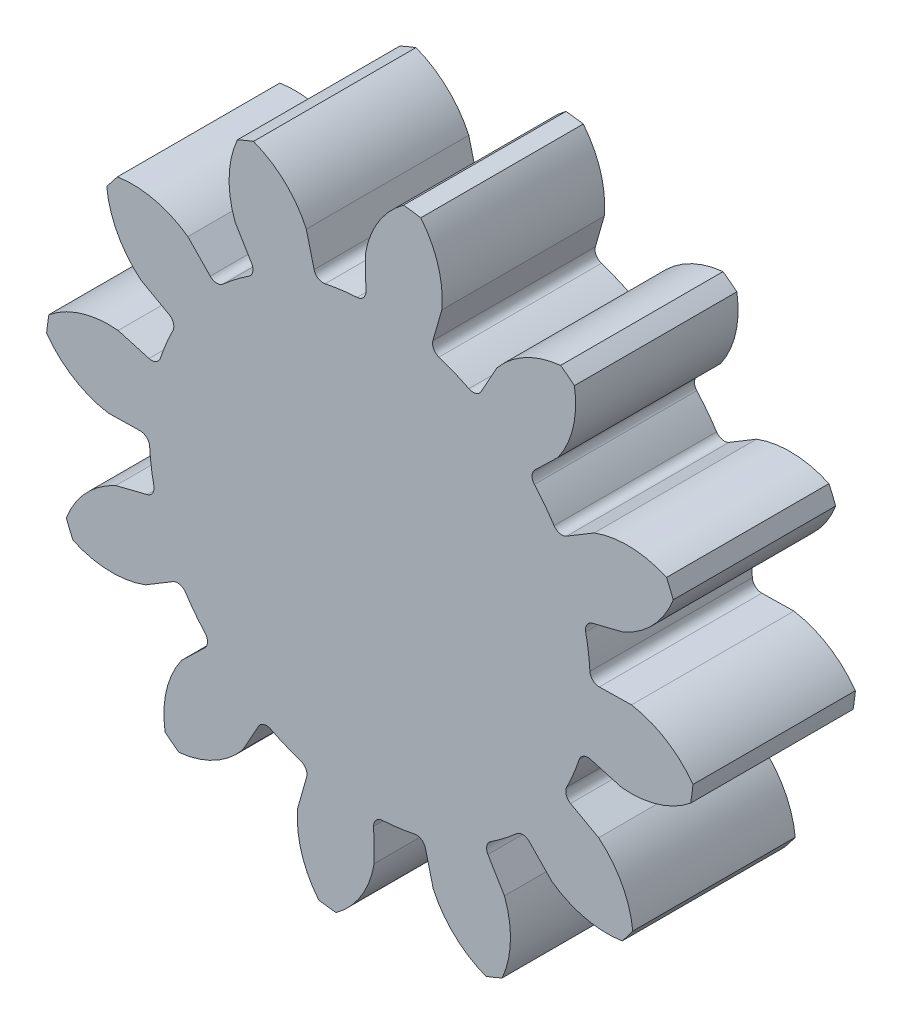
from build123d import *

# Parameters (mm, degrees)
EXTRUDE_1_DEPTH = 2.5


with BuildPart() as part:
    # 草图1 → 凸台-拉伸1 (new, symmetric)
    with BuildSketch(Plane.XY):
        with BuildLine():
            Line((-0.136485783, 8.054358659), (-0.119729389, 7.065523046))
            ThreePointArc((-0.119729389, 7.065523046), (-0.196017091, 6.866270148), (-0.389057023, 6.775401479))
            ThreePointArc((-0.389057023, 6.775401479), (-0.637871764, 6.756519087), (-0.885824161, 6.728502517))
            ThreePointArc((-0.885824161, 6.728502517), (-1.132579008, 6.691389643), (-1.377802715, 6.645230639))
            ThreePointArc((-1.377802715, 6.645230639), (-1.587783513, 6.683040623), (-1.713042218, 6.855759432))
            Line((-1.713042218, 6.855759432), (-1.952786274, 7.815238163))
            ThreePointArc((-1.952786274, 7.815238163), (-2.075107996, 8.053906443), (-2.218726264, 8.280399146))
            ThreePointArc((-2.218726264, 8.280399146), (-2.818977804, 8.911940261), (-3.578316614, 9.339199739))
            ThreePointArc((-3.578316614, 9.339199739), (-3.827312678, 9.239950175), (-4.073559524, 9.13406341))
            ThreePointArc((-4.073559524, 9.13406341), (-4.308375071, 8.295011713), (-4.28625, 7.424002774))
            ThreePointArc((-4.28625, 7.424002774), (-4.227648925, 7.162294797), (-4.145379485, 6.907036319))
            Line((-4.145379485, 6.907036319), (-3.636450216, 6.059057754))
            ThreePointArc((-3.636450216, 6.059057754), (-3.602890854, 5.848355832), (-3.724634005, 5.67314129))
            ThreePointArc((-3.724634005, 5.67314129), (-3.930672695, 5.532381289), (-4.131397486, 5.384142028))
            ThreePointArc((-4.131397486, 5.384142028), (-4.326537014, 5.228623914), (-4.515827472, 5.06603719))
            ThreePointArc((-4.515827472, 5.06603719), (-4.716581169, 4.993791197), (-4.911417795, 5.080740721))
            Line((-4.911417795, 5.080740721), (-5.598781603, 5.791801649))
            ThreePointArc((-5.598781603, 5.791801649), (-5.824049462, 5.937333581), (-6.061672882, 6.061672882))
            ThreePointArc((-6.061672882, 6.061672882), (-6.897276521, 6.308477761), (-7.76851296, 6.298825918))
            ThreePointArc((-7.76851296, 6.298825918), (-7.934525095, 6.088375242), (-8.094837736, 5.873551191))
            ThreePointArc((-8.094837736, 5.873551191), (-7.878668117, 5.029503333), (-7.424002774, 4.28625))
            ThreePointArc((-7.424002774, 4.28625), (-7.242398766, 4.088904781), (-7.043522102, 3.908979174))
            Line((-7.043522102, 3.908979174), (-6.178787143, 3.42907283))
            ThreePointArc((-6.178787143, 3.42907283), (-6.044372923, 3.263379294), (-6.062198313, 3.050767474))
            ThreePointArc((-6.062198313, 3.050767474), (-6.170253053, 2.825846392), (-6.26996619, 2.597105031))
            ThreePointArc((-6.26996619, 2.597105031), (-6.361202922, 2.364852629), (-6.443839905, 2.129403167))
            ThreePointArc((-6.443839905, 2.129403167), (-6.58157471, 1.966459453), (-6.79378294, 1.944341637))
            Line((-6.79378294, 1.944341637), (-7.744587923, 2.21645656))
            ThreePointArc((-7.744587923, 2.21645656), (-8.012441577, 2.229856981), (-8.280399146, 2.218726264))
            ThreePointArc((-8.280399146, 2.218726264), (-9.127455565, 2.014663739), (-9.877142532, 1.570686779))
            ThreePointArc((-9.877142532, 1.570686779), (-9.91568792, 1.30542508), (-9.947110714, 1.039225674))
            ThreePointArc((-9.947110714, 1.039225674), (-9.337878404, 0.416343596), (-8.5725, 0))
            ThreePointArc((-8.5725, 0), (-8.316553706, -0.080103969), (-8.054358659, -0.136485783))
            Line((-8.054358659, -0.136485783), (-7.065523046, -0.119729389))
            ThreePointArc((-7.065523046, -0.119729389), (-6.866270148, -0.196017091), (-6.775401479, -0.389057023))
            ThreePointArc((-6.775401479, -0.389057023), (-6.756519087, -0.637871764), (-6.728502517, -0.885824161))
            ThreePointArc((-6.728502517, -0.885824161), (-6.691389643, -1.132579008), (-6.645230639, -1.377802715))
            ThreePointArc((-6.645230639, -1.377802715), (-6.683040623, -1.587783513), (-6.855759432, -1.713042218))
            Line((-6.855759432, -1.713042218), (-7.815238163, -1.952786274))
            ThreePointArc((-7.815238163, -1.952786274), (-8.053906443, -2.075107996), (-8.280399146, -2.218726264))
            ThreePointArc((-8.280399146, -2.218726264), (-8.911940261, -2.818977804), (-9.339199739, -3.578316614))
            ThreePointArc((-9.339199739, -3.578316614), (-9.239950175, -3.827312678), (-9.13406341, -4.073559524))
            ThreePointArc((-9.13406341, -4.073559524), (-8.295011713, -4.308375071), (-7.424002774, -4.28625))
            ThreePointArc((-7.424002774, -4.28625), (-7.162294797, -4.227648925), (-6.907036319, -4.145379485))
            Line((-6.907036319, -4.145379485), (-6.059057754, -3.636450216))
            ThreePointArc((-6.059057754, -3.636450216), (-5.848355832, -3.602890854), (-5.67314129, -3.724634005))
            ThreePointArc((-5.67314129, -3.724634005), (-5.532381289, -3.930672695), (-5.384142028, -4.131397486))
            ThreePointArc((-5.384142028, -4.131397486), (-5.228623914, -4.326537014), (-5.06603719, -4.515827472))
            ThreePointArc((-5.06603719, -4.515827472), (-4.993791197, -4.716581169), (-5.080740721, -4.911417795))
            Line((-5.080740721, -4.911417795), (-5.791801649, -5.598781603))
            ThreePointArc((-5.791801649, -5.598781603), (-5.937333581, -5.824049462), (-6.061672882, -6.061672882))
            ThreePointArc((-6.061672882, -6.061672882), (-6.308477761, -6.897276521), (-6.298825918, -7.76851296))
            ThreePointArc((-6.298825918, -7.76851296), (-6.088375242, -7.934525095), (-5.873551191, -8.094837736))
            ThreePointArc((-5.873551191, -8.094837736), (-5.029503333, -7.878668117), (-4.28625, -7.424002774))
            ThreePointArc((-4.28625, -7.424002774), (-4.088904781, -7.242398766), (-3.908979174, -7.043522102))
            Line((-3.908979174, -7.043522102), (-3.42907283, -6.178787143))
            ThreePointArc((-3.42907283, -6.178787143), (-3.263379294, -6.044372923), (-3.050767474, -6.062198313))
            ThreePointArc((-3.050767474, -6.062198313), (-2.825846392, -6.170253053), (-2.597105031, -6.26996619))
            ThreePointArc((-2.597105031, -6.26996619), (-2.364852629, -6.361202922), (-2.129403167, -6.443839905))
            ThreePointArc((-2.129403167, -6.443839905), (-1.966459453, -6.58157471), (-1.944341637, -6.79378294))
            Line((-1.944341637, -6.79378294), (-2.21645656, -7.744587923))
            ThreePointArc((-2.21645656, -7.744587923), (-2.229856981, -8.012441577), (-2.218726264, -8.280399146))
            ThreePointArc((-2.218726264, -8.280399146), (-2.014663739, -9.127455565), (-1.570686779, -9.877142532))
            ThreePointArc((-1.570686779, -9.877142532), (-1.30542508, -9.91568792), (-1.039225674, -9.947110714))
            ThreePointArc((-1.039225674, -9.947110714), (-0.416343596, -9.337878404), (0, -8.5725))
            ThreePointArc((0, -8.5725), (0.080103969, -8.316553706), (0.136485783, -8.054358659))
            Line((0.136485783, -8.054358659), (0.119729389, -7.065523046))
            ThreePointArc((0.119729389, -7.065523046), (0.196017091, -6.866270148), (0.389057023, -6.775401479))
            ThreePointArc((0.389057023, -6.775401479), (0.637871764, -6.756519087), (0.885824161, -6.728502517))
            ThreePointArc((0.885824161, -6.728502517), (1.132579008, -6.691389643), (1.377802715, -6.645230639))
            ThreePointArc((1.377802715, -6.645230639), (1.587783513, -6.683040623), (1.713042218, -6.855759432))
            Line((1.713042218, -6.855759432), (1.952786274, -7.815238163))
            ThreePointArc((1.952786274, -7.815238163), (2.075107996, -8.053906443), (2.218726264, -8.280399146))
            ThreePointArc((2.218726264, -8.280399146), (2.818977804, -8.911940261), (3.578316614, -9.339199739))
            ThreePointArc((3.578316614, -9.339199739), (3.827312678, -9.239950175), (4.073559524, -9.13406341))
            ThreePointArc((4.073559524, -9.13406341), (4.308375071, -8.295011713), (4.28625, -7.424002774))
            ThreePointArc((4.28625, -7.424002774), (4.227648925, -7.162294797), (4.145379485, -6.907036319))
            Line((4.145379485, -6.907036319), (3.636450216, -6.059057754))
            ThreePointArc((3.636450216, -6.059057754), (3.602890854, -5.848355832), (3.724634005, -5.67314129))
            ThreePointArc((3.724634005, -5.67314129), (3.930672695, -5.532381289), (4.131397486, -5.384142028))
            ThreePointArc((4.131397486, -5.384142028), (4.326537014, -5.228623914), (4.515827472, -5.06603719))
            ThreePointArc((4.515827472, -5.06603719), (4.716581169, -4.993791197), (4.911417795, -5.080740721))
            Line((4.911417795, -5.080740721), (5.598781603, -5.791801649))
            ThreePointArc((5.598781603, -5.791801649), (5.824049462, -5.937333581), (6.061672882, -6.061672882))
            ThreePointArc((6.061672882, -6.061672882), (6.897276521, -6.308477761), (7.76851296, -6.298825918))
            ThreePointArc((7.76851296, -6.298825918), (7.934525095, -6.088375242), (8.094837736, -5.873551191))
            ThreePointArc((8.094837736, -5.873551191), (7.878668117, -5.029503333), (7.424002774, -4.28625))
            ThreePointArc((7.424002774, -4.28625), (7.242398766, -4.088904781), (7.043522102, -3.908979174))
            Line((7.043522102, -3.908979174), (6.178787143, -3.42907283))
            ThreePointArc((6.178787143, -3.42907283), (6.044372923, -3.263379294), (6.062198313, -3.050767474))
            ThreePointArc((6.062198313, -3.050767474), (6.170253053, -2.825846392), (6.26996619, -2.597105031))
            ThreePointArc((6.26996619, -2.597105031), (6.361202922, -2.364852629), (6.443839905, -2.129403167))
            ThreePointArc((6.443839905, -2.129403167), (6.58157471, -1.966459453), (6.79378294, -1.944341637))
            Line((6.79378294, -1.944341637), (7.744587923, -2.21645656))
            ThreePointArc((7.744587923, -2.21645656), (8.012441577, -2.229856981), (8.280399146, -2.218726264))
            ThreePointArc((8.280399146, -2.218726264), (9.127455565, -2.014663739), (9.877142532, -1.570686779))
            ThreePointArc((9.877142532, -1.570686779), (9.91568792, -1.30542508), (9.947110714, -1.039225674))
            ThreePointArc((9.947110714, -1.039225674), (9.337878404, -0.416343596), (8.5725, 0))
            ThreePointArc((8.5725, 0), (8.316553706, 0.080103969), (8.054358659, 0.136485783))
            Line((8.054358659, 0.136485783), (7.065523046, 0.119729389))
            ThreePointArc((7.065523046, 0.119729389), (6.866270148, 0.196017091), (6.775401479, 0.389057023))
            ThreePointArc((6.775401479, 0.389057023), (6.756519087, 0.637871764), (6.728502517, 0.885824161))
            ThreePointArc((6.728502517, 0.885824161), (6.691389643, 1.132579008), (6.645230639, 1.377802715))
            ThreePointArc((6.645230639, 1.377802715), (6.683040623, 1.587783513), (6.855759432, 1.713042218))
            Line((6.855759432, 1.713042218), (7.815238163, 1.952786274))
            ThreePointArc((7.815238163, 1.952786274), (8.053906443, 2.075107996), (8.280399146, 2.218726264))
            ThreePointArc((8.280399146, 2.218726264), (8.911940261, 2.818977804), (9.339199739, 3.578316614))
            ThreePointArc((9.339199739, 3.578316614), (9.239950175, 3.827312678), (9.13406341, 4.073559524))
            ThreePointArc((9.13406341, 4.073559524), (8.295011713, 4.308375071), (7.424002774, 4.28625))
            ThreePointArc((7.424002774, 4.28625), (7.162294797, 4.227648925), (6.907036319, 4.145379485))
            Line((6.907036319, 4.145379485), (6.059057754, 3.636450216))
            ThreePointArc((6.059057754, 3.636450216), (5.848355832, 3.602890854), (5.67314129, 3.724634005))
            ThreePointArc((5.67314129, 3.724634005), (5.532381289, 3.930672695), (5.384142028, 4.131397486))
            ThreePointArc((5.384142028, 4.131397486), (5.228623914, 4.326537014), (5.06603719, 4.515827472))
            ThreePointArc((5.06603719, 4.515827472), (4.993791197, 4.716581169), (5.080740721, 4.911417795))
            Line((5.080740721, 4.911417795), (5.791801649, 5.598781603))
            ThreePointArc((5.791801649, 5.598781603), (5.937333581, 5.824049462), (6.061672882, 6.061672882))
            ThreePointArc((6.061672882, 6.061672882), (6.308477761, 6.897276521), (6.298825918, 7.76851296))
            ThreePointArc((6.298825918, 7.76851296), (6.088375242, 7.934525095), (5.873551191, 8.094837736))
            ThreePointArc((5.873551191, 8.094837736), (5.029503333, 7.878668117), (4.28625, 7.424002774))
            ThreePointArc((4.28625, 7.424002774), (4.088904781, 7.242398766), (3.908979174, 7.043522102))
            Line((3.908979174, 7.043522102), (3.42907283, 6.178787143))
            ThreePointArc((3.42907283, 6.178787143), (3.263379294, 6.044372923), (3.050767474, 6.062198313))
            ThreePointArc((3.050767474, 6.062198313), (2.825846392, 6.170253053), (2.597105031, 6.26996619))
            ThreePointArc((2.597105031, 6.26996619), (2.364852629, 6.361202922), (2.129403167, 6.443839905))
            ThreePointArc((2.129403167, 6.443839905), (1.966459453, 6.58157471), (1.944341637, 6.79378294))
            Line((1.944341637, 6.79378294), (2.21645656, 7.744587923))
            ThreePointArc((2.21645656, 7.744587923), (2.229856981, 8.012441577), (2.218726264, 8.280399146))
            ThreePointArc((2.218726264, 8.280399146), (2.014663739, 9.127455565), (1.570686779, 9.877142532))
            ThreePointArc((1.570686779, 9.877142532), (1.30542508, 9.91568792), (1.039225674, 9.947110714))
            ThreePointArc((1.039225674, 9.947110714), (0.416343596, 9.337878404), (0, 8.5725))
            ThreePointArc((0, 8.5725), (-0.080103969, 8.316553706), (-0.136485783, 8.054358659))
        make_face()
    extrude(amount=EXTRUDE_1_DEPTH, both=True)


solid = part.part
